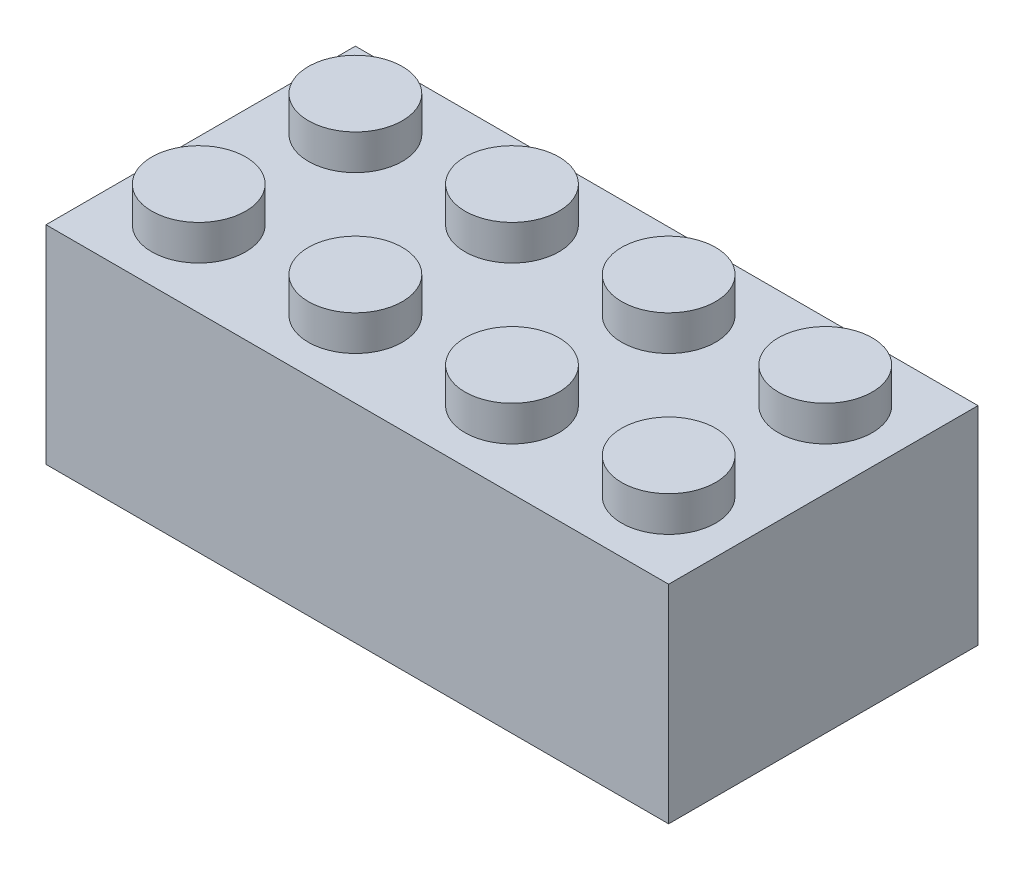
from build123d import *

# Parameters (mm, degrees)
SKETCH1_W               = 807.72
SKETCH1_H               = 401.32
BOSS_EXTRUDE1_DEPTH     = 25.4
SKETCH1_3_W             = 807.72
SKETCH1_3_H             = 401.32
BOSS_EXTRUDE2_DEPTH     = 243.84
SKETCH2_R               = 60.96
BOSS_EXTRUDE3_DEPTH     = 45.72
SKETCH3_R               = 82.55
SKETCH3_R_2             = 52.07
BOSS_EXTRUDE4_DEPTH     = 243.84
BOSS_EXTRUDE5_DEPTH     = 167.64
CUT_EXTRUDE3_DEPTH      = 25.4
CUT_EXTRUDE3_DEPTH_BACK = 25.4
SKETCH2_6_R             = 30.48


with BuildPart() as part:
    # Sketch1 → Boss-Extrude1 (new body)
    # profile 1 of 2: a face of its own
    with BuildSketch(Plane(origin=(0, 0, 0), x_dir=(1, 0, 0), z_dir=(0, 1, 0))):
        with Locations((-96.713172489, -45.20036793)):
            Rectangle(SKETCH1_W, SKETCH1_H)
        Polygon((271.586827511, 41.15963207), (276.666827511, 41.15963207), (276.666827511, -131.56036793), (271.586827511, -131.56036793), (271.586827511, -162.04036793), (276.666827511, -162.04036793), (276.666827511, -215.38036793), (-470.093172489, -215.38036793), (-470.093172489, -162.04036793), (-465.013172489, -162.04036793), (-465.013172489, -131.56036793), (-470.093172489, -131.56036793), (-470.093172489, 41.15963207), (-465.013172489, 41.15963207), (-465.013172489, 71.63963207), (-470.093172489, 71.63963207), (-470.093172489, 124.97963207), (-416.753172489, 124.97963207), (-416.753172489, 119.89963207), (-386.273172489, 119.89963207), (-386.273172489, 124.97963207), (-206.418642564, 124.97963207), (-206.418642564, 119.89963207), (-175.951162142, 119.89963207), (-175.951162142, 124.97963207), (-17.475182836, 124.97963207), (-17.475182836, 119.89963207), (12.992297586, 119.89963207), (12.992297586, 124.97963207), (192.846827511, 124.97963207), (192.846827511, 119.89963207), (223.326827511, 119.89963207), (223.326827511, 124.97963207), (276.666827511, 124.97963207), (276.666827511, 71.63963207), (271.586827511, 71.63963207), align=None, mode=Mode.SUBTRACT)
    # profile 2 of 2: a face of its own
    with BuildSketch(Plane(origin=(0, 0, 0), x_dir=(1, 0, 0), z_dir=(0, 1, 0))):
        Polygon((276.666827511, 41.15963207), (276.666827511, -131.56036793), (271.586827511, -131.56036793), (271.586827511, -162.04036793), (276.666827511, -162.04036793), (276.666827511, -215.38036793), (-470.093172489, -215.38036793), (-470.093172489, -162.04036793), (-465.013172489, -162.04036793), (-465.013172489, -131.56036793), (-470.093172489, -131.56036793), (-470.093172489, 41.15963207), (-465.013172489, 41.15963207), (-465.013172489, 71.63963207), (-470.093172489, 71.63963207), (-470.093172489, 124.97963207), (-416.753172489, 124.97963207), (-416.753172489, 119.89963207), (-386.273172489, 119.89963207), (-386.273172489, 124.97963207), (-206.418642564, 124.97963207), (-206.418642564, 119.89963207), (-175.951162142, 119.89963207), (-175.951162142, 124.97963207), (-17.475182836, 124.97963207), (-17.475182836, 119.89963207), (12.992297586, 119.89963207), (12.992297586, 124.97963207), (192.846827511, 124.97963207), (192.846827511, 119.89963207), (223.326827511, 119.89963207), (223.326827511, 124.97963207), (276.666827511, 124.97963207), (276.666827511, 71.63963207), (271.586827511, 71.63963207), (271.586827511, 41.15963207), align=None)
    extrude(amount=BOSS_EXTRUDE1_DEPTH)

    # Sketch1<3> → Boss-Extrude2 (add)
    with BuildSketch(Plane(origin=(0, 0, 0), x_dir=(1, 0, 0), z_dir=(0, 1, 0))):
        with Locations((-96.713172489, -45.20036793)):
            Rectangle(SKETCH1_3_W, SKETCH1_3_H)
        Polygon((-416.753172489, 124.97963207), (-416.753172489, 119.89963207), (-386.273172489, 119.89963207), (-386.273172489, 124.97963207), (-206.418642564, 124.97963207), (-206.418642564, 119.89963207), (-175.951162142, 119.89963207), (-175.951162142, 124.97963207), (-17.475182836, 124.97963207), (-17.475182836, 119.89963207), (12.992297586, 119.89963207), (12.992297586, 124.97963207), (192.846827511, 124.97963207), (192.846827511, 119.89963207), (223.326827511, 119.89963207), (223.326827511, 124.97963207), (276.666827511, 124.97963207), (276.666827511, 71.63963207), (271.586827511, 71.63963207), (271.586827511, 41.15963207), (276.666827511, 41.15963207), (276.666827511, -131.56036793), (271.586827511, -131.56036793), (271.586827511, -162.04036793), (276.666827511, -162.04036793), (276.666827511, -215.38036793), (-470.093172489, -215.38036793), (-470.093172489, -162.04036793), (-465.013172489, -162.04036793), (-465.013172489, -131.56036793), (-470.093172489, -131.56036793), (-470.093172489, 41.15963207), (-465.013172489, 41.15963207), (-465.013172489, 71.63963207), (-470.093172489, 71.63963207), (-470.093172489, 124.97963207), align=None, mode=Mode.SUBTRACT)
    extrude(amount=-BOSS_EXTRUDE2_DEPTH)

    # Sketch2 → Boss-Extrude3 (add)
    with BuildSketch(Plane(origin=(0, 25.4, 0), x_dir=(1, 0, 0), z_dir=(0, 1, 0))):
        with Locations(Location((-401.513172489, 56.39963207, 0), (0, 0, 270))):
            Circle(SKETCH2_R)
        with Locations(Location((-198.313172489, 56.39963207, 0), (0, 0, 270))):
            Circle(SKETCH2_R)
        with Locations(Location((-198.313172489, -146.80036793, 0), (0, 0, 270))):
            Circle(SKETCH2_R)
        with Locations(Location((-401.513172489, -146.80036793, 0), (0, 0, 270))):
            Circle(SKETCH2_R)
        with Locations(Location((208.086827511, -146.80036793, 0), (0, 0, 270))):
            Circle(SKETCH2_R)
        with Locations(Location((4.886827511, -146.80036793, 0), (0, 0, 270))):
            Circle(SKETCH2_R)
        with Locations(Location((4.886827511, 56.39963207, 0), (0, 0, 270))):
            Circle(SKETCH2_R)
        with Locations(Location((208.086827511, 56.39963207, 0), (0, 0, 270))):
            Circle(SKETCH2_R)
    extrude(amount=BOSS_EXTRUDE3_DEPTH)

    # Sketch3 → Boss-Extrude4 (add)
    # profile 1 of 3: a face of its own
    with BuildSketch(Plane.XZ):
        with Locations(Location((106.486827511, 45.20036793, 0), (0, 0, 90))):
            Circle(SKETCH3_R)
        with Locations(Location((106.486827511, 45.20036793, 0), (0, 0, 90))):
            Circle(SKETCH3_R_2, mode=Mode.SUBTRACT)
    # profile 2 of 3: a face of its own
    with BuildSketch(Plane.XZ):
        with Locations(Location((-96.713172489, 45.20036793, 0), (0, 0, 90))):
            Circle(SKETCH3_R)
        with Locations(Location((-96.713172489, 45.20036793, 0), (0, 0, 90))):
            Circle(SKETCH3_R_2, mode=Mode.SUBTRACT)
    # profile 3 of 3: a face of its own
    with BuildSketch(Plane.XZ):
        with Locations(Location((-299.913172489, 45.20036793, 0), (0, 0, 90))):
            Circle(SKETCH3_R)
        with Locations(Location((-299.913172489, 45.20036793, 0), (0, 0, 90))):
            Circle(SKETCH3_R_2, mode=Mode.SUBTRACT)
    extrude(amount=BOSS_EXTRUDE4_DEPTH)

    # Sketch3<4> → Boss-Extrude5 (add)
    with BuildSketch(Plane.XZ):
        with BuildLine():
            Line((-110.683172489, 215.38036793), (-110.683172489, 126.55970421))
            ThreePointArc((-110.683172489, 126.55970421), (-96.713172489, 127.75036793), (-82.743172489, 126.55970421))
            Line((-82.743172489, 126.55970421), (-82.743172489, 215.38036793))
            Line((-82.743172489, 215.38036793), (-110.683172489, 215.38036793))
        make_face()
        with BuildLine():
            ThreePointArc((-82.743172489, -36.158968351), (-96.713172489, -37.34963207), (-110.683172489, -36.158968351))
            Line((-110.683172489, -36.158968351), (-110.683172489, -124.97963207))
            Line((-110.683172489, -124.97963207), (-82.743172489, -124.97963207))
            Line((-82.743172489, -124.97963207), (-82.743172489, -36.158968351))
        make_face()
    extrude(amount=BOSS_EXTRUDE5_DEPTH)

    # Sketch2<6> → Cut-Extrude3 (cut, two sides: drawn at the far end of the back side and taken through both)
    with BuildSketch(Plane(origin=(0, 25.4, 0), x_dir=(1, 0, 0), z_dir=(0, 1, 0)).offset(-CUT_EXTRUDE3_DEPTH_BACK)):
        with Locations(Location((-401.513172489, 56.39963207, 0), (0, 0, 270))):
            Circle(SKETCH2_6_R)
        with Locations(Location((-198.313172489, 56.39963207, 0), (0, 0, 270))):
            Circle(SKETCH2_6_R)
        with Locations(Location((-198.313172489, -146.80036793, 0), (0, 0, 270))):
            Circle(SKETCH2_6_R)
        with Locations(Location((208.086827511, -146.80036793, 0), (0, 0, 270))):
            Circle(SKETCH2_6_R)
        with Locations(Location((208.086827511, 56.39963207, 0), (0, 0, 270))):
            Circle(SKETCH2_6_R)
        with Locations(Location((-401.513172489, -146.80036793, 0), (0, 0, 90))):
            Circle(SKETCH2_6_R)
        with Locations(Location((4.886827511, -146.80036793, 0), (0, 0, 270))):
            Circle(SKETCH2_6_R)
    extrude(amount=CUT_EXTRUDE3_DEPTH + CUT_EXTRUDE3_DEPTH_BACK, mode=Mode.SUBTRACT)


solid = part.part
